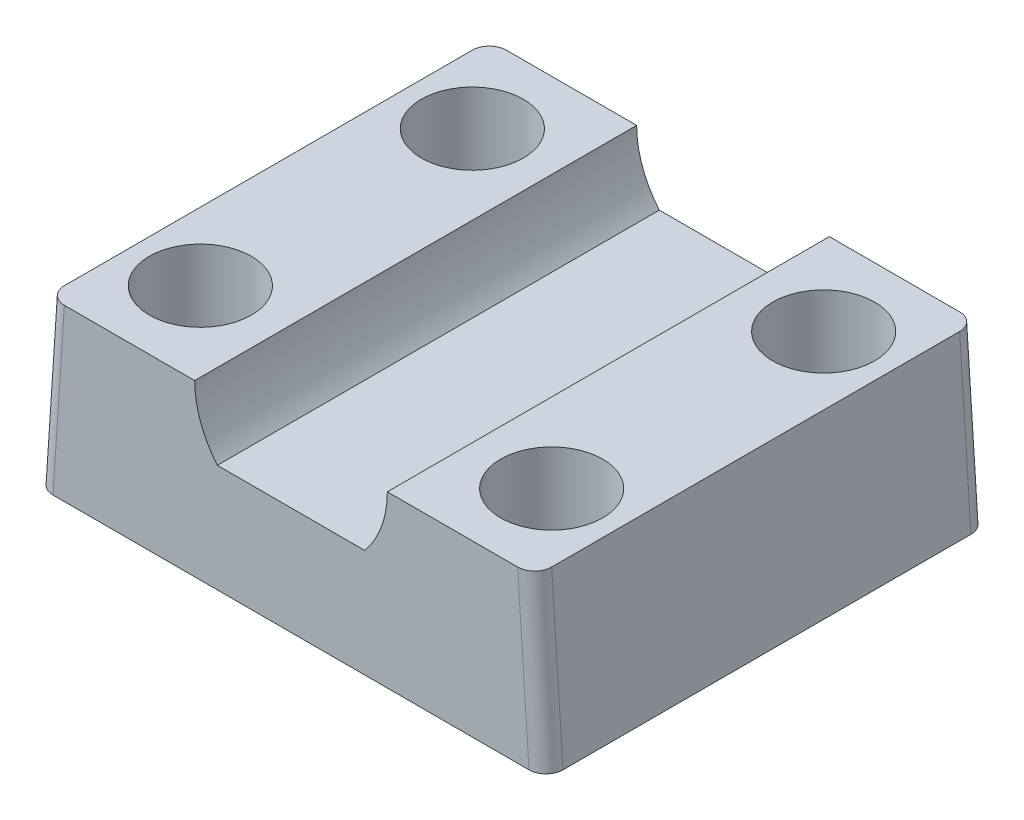
from build123d import *

# Parameters (mm, degrees)
ESTRUSIONE_ESTRUSIONE1_DEPTH = 39
FORO_PER_VITE_M8_1_D         = 9
FORO_PER_VITE_M8_1_DEPTH     = 30
FORO_PER_VITE_M8_1_TIP       = 2.703872786
RACCORDO1_R                  = 1.5


with BuildPart() as part:
    # Schizzo1 → Estrusione-Estrusione1 (new body)
    with BuildSketch(Plane.XY):
        with BuildLine():
            Line((-21.5, 15), (-22.5, 0))
            Line((-22.5, 0), (22.5, 0))
            Line((22.5, 0), (21.5, 15))
            Line((21.5, 15), (8.5, 15))
            ThreePointArc((8.5, 15), (7.984359711, 12.084524053), (6.5, 9.522774425))
            Line((6.5, 9.522774425), (-6.5, 9.522774425))
            ThreePointArc((-6.5, 9.522774425), (-7.984359711, 12.084524053), (-8.5, 15))
            Line((-8.5, 15), (-21.5, 15))
        make_face()
    extrude(amount=ESTRUSIONE_ESTRUSIONE1_DEPTH)

    # Foro per Vite M8-1
    with Locations(Plane(origin=(0, 0, 0), x_dir=(-1, 0, 0), z_dir=(0, -1, 0))):
        with Locations((-15.5, -31.5), (15.5, -31.5), (15.5, -7.5), (-15.5, -7.5)):
            Hole(FORO_PER_VITE_M8_1_D / 2, depth=FORO_PER_VITE_M8_1_DEPTH)
            with Locations((0, 0, -(FORO_PER_VITE_M8_1_DEPTH + FORO_PER_VITE_M8_1_TIP / 2))):  # 118° drill point
                Cone(0, FORO_PER_VITE_M8_1_D / 2, FORO_PER_VITE_M8_1_TIP, mode=Mode.SUBTRACT)

    # Raccordo1
    raccordo1_edges = [part.edges().sort_by_distance(p)[0] for p in [
        (22, 7.5, 0),
        (-22, 7.5, 0),
        (22, 7.5, 39),
        (-22, 7.5, 39),
    ]]
    fillet(raccordo1_edges, radius=RACCORDO1_R)


solid = part.part
